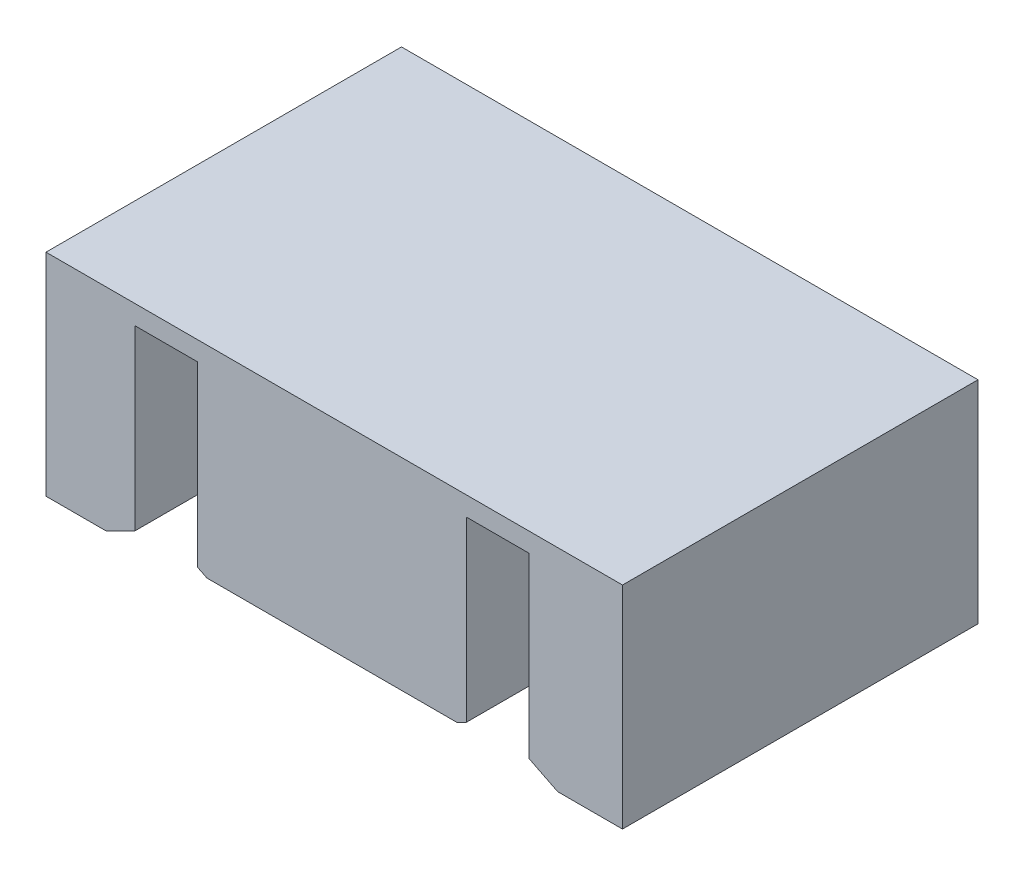
from build123d import *

# Parameters (mm, degrees)
SKETCH1_W           = 60
SKETCH1_H           = 45
BOSS_EXTRUDE1_DEPTH = 30
SKETCH2_W           = 6.5
SKETCH2_H           = 22
CUT_EXTRUDE1_DEPTH  = 20
CUT_EXTRUDE2_DEPTH  = 10
CHAMFER3_SIZE       = 3
CHAMFER3_SIZE2      = 1.5
CUT_EXTRUDE3_REACH  = 82.777
SKETCH6_W           = 28
SKETCH6_H           = 31
CUT_EXTRUDE4_DEPTH  = 1
SKETCH7_W           = 6.5
SKETCH7_H           = 8
CUT_EXTRUDE5_DEPTH  = 6
CHAMFER4_SIZE       = 2


with BuildPart() as part:
    # Sketch1 → Boss-Extrude1 (new body)
    with BuildSketch(Plane(origin=(0, 0, 0), x_dir=(1, 0, 0), z_dir=(0, 1, 0))):
        with Locations((-30, 22.5)):
            Rectangle(SKETCH1_W, SKETCH1_H)
    extrude(amount=BOSS_EXTRUDE1_DEPTH)

    # Sketch2 → Cut-Extrude1 (cut)
    with BuildSketch(Plane(origin=(0, 0, 0), x_dir=(-1, 0, 0), z_dir=(0, -1, 0))):
        with Locations((47.5, 18)):
            Rectangle(SKETCH2_W, SKETCH2_H)
        with Locations((13, 18)):
            Rectangle(SKETCH2_W, SKETCH2_H)
    extrude(amount=-CUT_EXTRUDE1_DEPTH, mode=Mode.SUBTRACT)

    # Sketch4 → Cut-Extrude2 (cut)
    with BuildSketch(Plane(origin=(0, 0, -45), x_dir=(-1, 0, 0), z_dir=(0, 0, -1))):
        with BuildLine():
            Line((11.5, 0), (28.3, 0))
            ThreePointArc((28.3, 0), (34.080602383, 6.276082414), (42.61191296, 6.13008847))
            ThreePointArc((42.61191296, 6.13008847), (47.088831578, 7.478397416), (46.230644896, 12.074510224))
            ThreePointArc((46.230644896, 12.074510224), (25.608734298, 15.404376803), (11.5, 0))
        make_face()
    extrude(amount=-CUT_EXTRUDE2_DEPTH, mode=Mode.SUBTRACT)

    # Chamfer3
    chamfer3_edges = [part.edges().sort_by_distance(p)[0] for p in [
        (-50.75, 0, -18),
        (-44.25, 0, -18),
        (-47.5, 0, -7),
        (-16.25, 0, -18),
        (-9.75, 0, -18),
        (-13, 0, -7),
    ]]
    chamfer3_side = [part.faces().sort_by_distance(p)[0] for p in [
        (-30.72364203, 0, -21.764024933),
    ]]
    chamfer(chamfer3_edges, length=CHAMFER3_SIZE, length2=CHAMFER3_SIZE2, reference=chamfer3_side[0])

    # Sketch5 → Cut-Extrude3 (cut, up to next)
    with BuildSketch(Plane.ZY.offset(60), mode=Mode.PRIVATE) as cut_extrude3_sk1:
        Polygon((-45, 30), (0, 30), (0, 0), (-8, 0), (-8, 22), (-45, 22), align=None)
    cut_extrude3_tool1 = extrude(cut_extrude3_sk1.sketch, amount=-CUT_EXTRUDE3_REACH, mode=Mode.PRIVATE) & part.part
    add(cut_extrude3_tool1.solids().sort_by_distance((-60, 29.459167, -22.5))[0], mode=Mode.SUBTRACT)

    # Sketch6 → Cut-Extrude4 (cut)
    with BuildSketch(Plane(origin=(0, 0, 0), x_dir=(-1, 0, 0), z_dir=(0, -1, 0))):
        with Locations((30.25, 23.5)):
            Rectangle(SKETCH6_W, SKETCH6_H)
    extrude(amount=-CUT_EXTRUDE4_DEPTH, mode=Mode.SUBTRACT)

    # Sketch7 → Cut-Extrude5 (cut)
    with BuildSketch(Plane.XY.offset(-29)):
        with Locations((-13, 16)):
            Rectangle(SKETCH7_W, SKETCH7_H)
        with Locations((-47.5, 16)):
            Rectangle(SKETCH7_W, SKETCH7_H)
    extrude(amount=-CUT_EXTRUDE5_DEPTH, mode=Mode.SUBTRACT)

    # Chamfer4
    chamfer4_edges = [part.edges().sort_by_distance(p)[0] for p in [
        (-13, 12, -29),
        (-47.5, 12, -29),
    ]]
    chamfer(chamfer4_edges, length=CHAMFER4_SIZE)


solid = part.part
